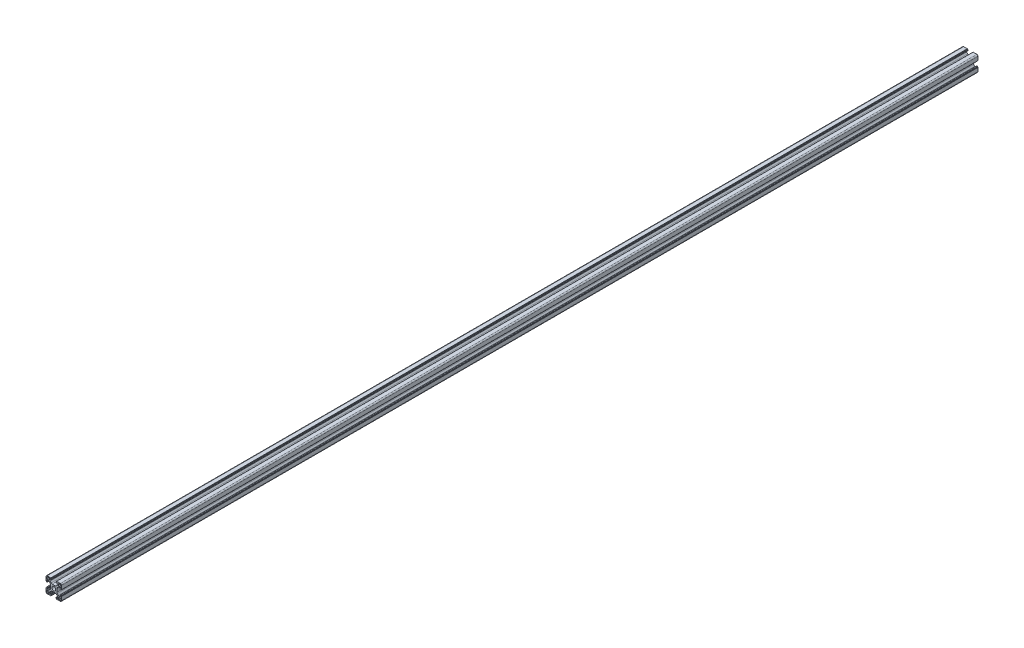
from build123d import *

# Parameters (mm, degrees)
EXTRUDE_1_DEPTH = 1180


with BuildPart() as part:
    # Эскиз1 → Бобышка-Вытянуть1 (new body)
    with BuildSketch(Plane.XY):
        with BuildLine():
            Line((0.259458272, 4.035699369), (2.158238941, 4.035699369))
            ThreePointArc((2.158238941, 4.035699369), (2.923605806, 4.187940304), (3.572452504, 4.621485807))
            Line((3.572452504, 4.621485807), (4.873671834, 5.922705138))
            ThreePointArc((4.873671834, 5.922705138), (5.307217337, 6.571551836), (5.459458272, 7.3369187))
            Line((5.459458272, 7.3369187), (5.459458272, 8.235699369))
            ThreePointArc((5.459458272, 8.235699369), (5.313011663, 8.58925276), (4.959458272, 8.735699369))
            Line((4.959458272, 8.735699369), (4.856565053, 8.735699369))
            ThreePointArc((4.856565053, 8.735699369), (4.665223337, 8.697639136), (4.503011663, 8.58925276))
            Line((4.503011663, 8.58925276), (4.022681577, 8.108922674))
            ThreePointArc((4.022681577, 8.108922674), (3.94157574, 8.054729486), (3.845904882, 8.035699369))
            Line((3.845904882, 8.035699369), (3.559458272, 8.035699369))
            ThreePointArc((3.559458272, 8.035699369), (3.382681577, 8.108922674), (3.309458272, 8.285699369))
            Line((3.309458272, 8.285699369), (3.309458272, 9.43477019))
            ThreePointArc((3.309458272, 9.43477019), (3.353392255, 9.540836207), (3.459458272, 9.58477019))
            Line((3.459458272, 9.58477019), (3.959458272, 9.58477019))
            Line((3.959458272, 9.58477019), (3.959458272, 9.885699369))
            ThreePointArc((3.959458272, 9.885699369), (4.003392255, 9.991765387), (4.109458272, 10.035699369))
            Line((4.109458272, 10.035699369), (8.759458272, 10.035699369))
            ThreePointArc((8.759458272, 10.035699369), (9.820118444, 9.596359541), (10.259458272, 8.535699369))
            Line((10.259458272, 8.535699369), (10.259458272, 3.885699369))
            ThreePointArc((10.259458272, 3.885699369), (10.215524289, 3.779633352), (10.109458272, 3.735699369))
            Line((10.109458272, 3.735699369), (9.808529093, 3.735699369))
            Line((9.808529093, 3.735699369), (9.808529093, 3.235699369))
            ThreePointArc((9.808529093, 3.235699369), (9.76459511, 3.129633352), (9.658529093, 3.085699369))
            Line((9.658529093, 3.085699369), (8.509458272, 3.085699369))
            ThreePointArc((8.509458272, 3.085699369), (8.332681577, 3.158922674), (8.259458272, 3.335699369))
            Line((8.259458272, 3.335699369), (8.259458272, 3.622145979))
            ThreePointArc((8.259458272, 3.622145979), (8.278488389, 3.717816837), (8.332681577, 3.798922674))
            Line((8.332681577, 3.798922674), (8.813011663, 4.27925276))
            ThreePointArc((8.813011663, 4.27925276), (8.921398038, 4.441464434), (8.959458272, 4.632806151))
            Line((8.959458272, 4.632806151), (8.959458272, 4.735699369))
            ThreePointArc((8.959458272, 4.735699369), (8.813011663, 5.08925276), (8.459458272, 5.235699369))
            Line((8.459458272, 5.235699369), (7.560677603, 5.235699369))
            ThreePointArc((7.560677603, 5.235699369), (6.795310738, 5.083458434), (6.146464041, 4.649912932))
            Line((6.146464041, 4.649912932), (4.84524471, 3.348693601))
            ThreePointArc((4.84524471, 3.348693601), (4.411699207, 2.699846903), (4.259458272, 1.934480039))
            Line((4.259458272, 1.934480039), (4.259458272, 0.035699369))
            Line((4.259458272, 0.035699369), (4.259458272, -1.8630813))
            ThreePointArc((4.259458272, -1.8630813), (4.411699207, -2.628448164), (4.84524471, -3.277294862))
            Line((4.84524471, -3.277294862), (6.146464041, -4.578514193))
            ThreePointArc((6.146464041, -4.578514193), (6.795310738, -5.012059696), (7.560677603, -5.164300631))
            Line((7.560677603, -5.164300631), (8.459458272, -5.164300631))
            ThreePointArc((8.459458272, -5.164300631), (8.813011663, -5.017854021), (8.959458272, -4.664300631))
            Line((8.959458272, -4.664300631), (8.959458272, -4.561407412))
            ThreePointArc((8.959458272, -4.561407412), (8.921398038, -4.370065696), (8.813011663, -4.207854021))
            Line((8.813011663, -4.207854021), (8.332681577, -3.727523935))
            ThreePointArc((8.332681577, -3.727523935), (8.278488389, -3.646418098), (8.259458272, -3.55074724))
            Line((8.259458272, -3.55074724), (8.259458272, -3.264300631))
            ThreePointArc((8.259458272, -3.264300631), (8.332681577, -3.087523935), (8.509458272, -3.014300631))
            Line((8.509458272, -3.014300631), (9.658529093, -3.014300631))
            ThreePointArc((9.658529093, -3.014300631), (9.76459511, -3.058234613), (9.808529093, -3.164300631))
            Line((9.808529093, -3.164300631), (9.808529093, -3.664300631))
            Line((9.808529093, -3.664300631), (10.109458272, -3.664300631))
            ThreePointArc((10.109458272, -3.664300631), (10.215524289, -3.708234613), (10.259458272, -3.814300631))
            Line((10.259458272, -3.814300631), (10.259458272, -8.464300631))
            ThreePointArc((10.259458272, -8.464300631), (9.820118444, -9.524960802), (8.759458272, -9.964300631))
            Line((8.759458272, -9.964300631), (4.109458272, -9.964300631))
            ThreePointArc((4.109458272, -9.964300631), (4.003392255, -9.920366648), (3.959458272, -9.814300631))
            Line((3.959458272, -9.814300631), (3.959458272, -9.513371451))
            Line((3.959458272, -9.513371451), (3.459458272, -9.513371451))
            ThreePointArc((3.459458272, -9.513371451), (3.353392255, -9.469437468), (3.309458272, -9.363371451))
            Line((3.309458272, -9.363371451), (3.309458272, -8.214300631))
            ThreePointArc((3.309458272, -8.214300631), (3.382681577, -8.037523935), (3.559458272, -7.964300631))
            Line((3.559458272, -7.964300631), (3.845904882, -7.964300631))
            ThreePointArc((3.845904882, -7.964300631), (3.94157574, -7.983330747), (4.022681577, -8.037523935))
            Line((4.022681577, -8.037523935), (4.503011663, -8.517854021))
            ThreePointArc((4.503011663, -8.517854021), (4.665223337, -8.626240397), (4.856565053, -8.664300631))
            Line((4.856565053, -8.664300631), (4.959458272, -8.664300631))
            ThreePointArc((4.959458272, -8.664300631), (5.313011663, -8.517854021), (5.459458272, -8.164300631))
            Line((5.459458272, -8.164300631), (5.459458272, -7.265519961))
            ThreePointArc((5.459458272, -7.265519961), (5.307217337, -6.500153097), (4.873671834, -5.851306399))
            Line((4.873671834, -5.851306399), (3.572452504, -4.550087068))
            ThreePointArc((3.572452504, -4.550087068), (2.923605806, -4.116541566), (2.158238941, -3.964300631))
            Line((2.158238941, -3.964300631), (0.259458272, -3.964300631))
            Line((0.259458272, -3.964300631), (-1.639322397, -3.964300631))
            ThreePointArc((-1.639322397, -3.964300631), (-2.404689262, -4.116541566), (-3.053535959, -4.550087068))
            Line((-3.053535959, -4.550087068), (-4.35475529, -5.851306399))
            ThreePointArc((-4.35475529, -5.851306399), (-4.788300793, -6.500153097), (-4.940541728, -7.265519961))
            Line((-4.940541728, -7.265519961), (-4.940541728, -8.164300631))
            ThreePointArc((-4.940541728, -8.164300631), (-4.794095118, -8.517854021), (-4.440541728, -8.664300631))
            Line((-4.440541728, -8.664300631), (-4.337648509, -8.664300631))
            ThreePointArc((-4.337648509, -8.664300631), (-4.146306793, -8.626240397), (-3.984095118, -8.517854021))
            Line((-3.984095118, -8.517854021), (-3.503765033, -8.037523935))
            ThreePointArc((-3.503765033, -8.037523935), (-3.422659195, -7.983330747), (-3.326988337, -7.964300631))
            Line((-3.326988337, -7.964300631), (-3.040541728, -7.964300631))
            ThreePointArc((-3.040541728, -7.964300631), (-2.863765033, -8.037523935), (-2.790541728, -8.214300631))
            Line((-2.790541728, -8.214300631), (-2.790541728, -9.363371451))
            ThreePointArc((-2.790541728, -9.363371451), (-2.834475711, -9.469437468), (-2.940541728, -9.513371451))
            Line((-2.940541728, -9.513371451), (-3.440541728, -9.513371451))
            Line((-3.440541728, -9.513371451), (-3.440541728, -9.814300631))
            ThreePointArc((-3.440541728, -9.814300631), (-3.484475711, -9.920366648), (-3.590541728, -9.964300631))
            Line((-3.590541728, -9.964300631), (-8.240541728, -9.964300631))
            ThreePointArc((-8.240541728, -9.964300631), (-9.3012019, -9.524960802), (-9.740541728, -8.464300631))
            Line((-9.740541728, -8.464300631), (-9.740541728, -3.814300631))
            ThreePointArc((-9.740541728, -3.814300631), (-9.696607745, -3.708234613), (-9.590541728, -3.664300631))
            Line((-9.590541728, -3.664300631), (-9.289612548, -3.664300631))
            Line((-9.289612548, -3.664300631), (-9.289612548, -3.164300631))
            ThreePointArc((-9.289612548, -3.164300631), (-9.245678566, -3.058234613), (-9.139612548, -3.014300631))
            Line((-9.139612548, -3.014300631), (-7.990541728, -3.014300631))
            ThreePointArc((-7.990541728, -3.014300631), (-7.813765033, -3.087523935), (-7.740541728, -3.264300631))
            Line((-7.740541728, -3.264300631), (-7.740541728, -3.55074724))
            ThreePointArc((-7.740541728, -3.55074724), (-7.759571845, -3.646418098), (-7.813765033, -3.727523935))
            Line((-7.813765033, -3.727523935), (-8.294095118, -4.207854021))
            ThreePointArc((-8.294095118, -4.207854021), (-8.402481494, -4.370065696), (-8.440541728, -4.561407412))
            Line((-8.440541728, -4.561407412), (-8.440541728, -4.664300631))
            ThreePointArc((-8.440541728, -4.664300631), (-8.294095118, -5.017854021), (-7.940541728, -5.164300631))
            Line((-7.940541728, -5.164300631), (-7.041761059, -5.164300631))
            ThreePointArc((-7.041761059, -5.164300631), (-6.276394194, -5.012059696), (-5.627547496, -4.578514193))
            Line((-5.627547496, -4.578514193), (-4.326328166, -3.277294862))
            ThreePointArc((-4.326328166, -3.277294862), (-3.892782663, -2.628448164), (-3.740541728, -1.8630813))
            Line((-3.740541728, -1.8630813), (-3.740541728, 0.035699369))
            Line((-3.740541728, 0.035699369), (-3.740541728, 1.934480039))
            ThreePointArc((-3.740541728, 1.934480039), (-3.892782663, 2.699846903), (-4.326328166, 3.348693601))
            Line((-4.326328166, 3.348693601), (-5.627547496, 4.649912932))
            ThreePointArc((-5.627547496, 4.649912932), (-6.276394194, 5.083458434), (-7.041761059, 5.235699369))
            Line((-7.041761059, 5.235699369), (-7.940541728, 5.235699369))
            ThreePointArc((-7.940541728, 5.235699369), (-8.294095118, 5.08925276), (-8.440541728, 4.735699369))
            Line((-8.440541728, 4.735699369), (-8.440541728, 4.632806151))
            ThreePointArc((-8.440541728, 4.632806151), (-8.402481494, 4.441464434), (-8.294095118, 4.27925276))
            Line((-8.294095118, 4.27925276), (-7.813765033, 3.798922674))
            ThreePointArc((-7.813765033, 3.798922674), (-7.759571845, 3.717816837), (-7.740541728, 3.622145979))
            Line((-7.740541728, 3.622145979), (-7.740541728, 3.335699369))
            ThreePointArc((-7.740541728, 3.335699369), (-7.813765033, 3.158922674), (-7.990541728, 3.085699369))
            Line((-7.990541728, 3.085699369), (-9.139612548, 3.085699369))
            ThreePointArc((-9.139612548, 3.085699369), (-9.245678566, 3.129633352), (-9.289612548, 3.235699369))
            Line((-9.289612548, 3.235699369), (-9.289612548, 3.735699369))
            Line((-9.289612548, 3.735699369), (-9.590541728, 3.735699369))
            ThreePointArc((-9.590541728, 3.735699369), (-9.696607745, 3.779633352), (-9.740541728, 3.885699369))
            Line((-9.740541728, 3.885699369), (-9.740541728, 8.535699369))
            ThreePointArc((-9.740541728, 8.535699369), (-9.3012019, 9.596359541), (-8.240541728, 10.035699369))
            Line((-8.240541728, 10.035699369), (-3.590541728, 10.035699369))
            ThreePointArc((-3.590541728, 10.035699369), (-3.484475711, 9.991765387), (-3.440541728, 9.885699369))
            Line((-3.440541728, 9.885699369), (-3.440541728, 9.58477019))
            Line((-3.440541728, 9.58477019), (-2.940541728, 9.58477019))
            ThreePointArc((-2.940541728, 9.58477019), (-2.834475711, 9.540836207), (-2.790541728, 9.43477019))
            Line((-2.790541728, 9.43477019), (-2.790541728, 8.285699369))
            ThreePointArc((-2.790541728, 8.285699369), (-2.863765033, 8.108922674), (-3.040541728, 8.035699369))
            Line((-3.040541728, 8.035699369), (-3.326988337, 8.035699369))
            ThreePointArc((-3.326988337, 8.035699369), (-3.422659195, 8.054729486), (-3.503765033, 8.108922674))
            Line((-3.503765033, 8.108922674), (-3.984095118, 8.58925276))
            ThreePointArc((-3.984095118, 8.58925276), (-4.146306793, 8.697639136), (-4.337648509, 8.735699369))
            Line((-4.337648509, 8.735699369), (-4.440541728, 8.735699369))
            ThreePointArc((-4.440541728, 8.735699369), (-4.794095118, 8.58925276), (-4.940541728, 8.235699369))
            Line((-4.940541728, 8.235699369), (-4.940541728, 7.3369187))
            ThreePointArc((-4.940541728, 7.3369187), (-4.788300793, 6.571551836), (-4.35475529, 5.922705138))
            Line((-4.35475529, 5.922705138), (-3.053535959, 4.621485807))
            ThreePointArc((-3.053535959, 4.621485807), (-2.404689262, 4.187940304), (-1.639322397, 4.035699369))
            Line((-1.639322397, 4.035699369), (0.259458272, 4.035699369))
        make_face()
        with BuildLine():
            Line((7.159458272, 6.135699369), (8.559458272, 6.135699369))
            ThreePointArc((8.559458272, 6.135699369), (9.125143697, 6.370013944), (9.359458272, 6.935699369))
            Line((9.359458272, 6.935699369), (9.359458272, 8.335699369))
            ThreePointArc((9.359458272, 8.335699369), (9.125143697, 8.901384794), (8.559458272, 9.135699369))
            Line((8.559458272, 9.135699369), (7.159458272, 9.135699369))
            ThreePointArc((7.159458272, 9.135699369), (6.593772847, 8.901384794), (6.359458272, 8.335699369))
            Line((6.359458272, 8.335699369), (6.359458272, 6.935699369))
            ThreePointArc((6.359458272, 6.935699369), (6.593772847, 6.370013944), (7.159458272, 6.135699369))
        make_face(mode=Mode.SUBTRACT)
        with BuildLine():
            Line((6.359458272, -6.864300631), (6.359458272, -8.264300631))
            ThreePointArc((6.359458272, -8.264300631), (6.593772847, -8.829986056), (7.159458272, -9.064300631))
            Line((7.159458272, -9.064300631), (8.559458272, -9.064300631))
            ThreePointArc((8.559458272, -9.064300631), (9.125143697, -8.829986056), (9.359458272, -8.264300631))
            Line((9.359458272, -8.264300631), (9.359458272, -6.864300631))
            ThreePointArc((9.359458272, -6.864300631), (9.125143697, -6.298615206), (8.559458272, -6.064300631))
            Line((8.559458272, -6.064300631), (7.159458272, -6.064300631))
            ThreePointArc((7.159458272, -6.064300631), (6.593772847, -6.298615206), (6.359458272, -6.864300631))
        make_face(mode=Mode.SUBTRACT)
        with BuildLine():
            Line((-6.640541728, -6.064300631), (-8.040541728, -6.064300631))
            ThreePointArc((-8.040541728, -6.064300631), (-8.606227153, -6.298615206), (-8.840541728, -6.864300631))
            Line((-8.840541728, -6.864300631), (-8.840541728, -8.264300631))
            ThreePointArc((-8.840541728, -8.264300631), (-8.606227153, -8.829986056), (-8.040541728, -9.064300631))
            Line((-8.040541728, -9.064300631), (-6.640541728, -9.064300631))
            ThreePointArc((-6.640541728, -9.064300631), (-6.074856303, -8.829986056), (-5.840541728, -8.264300631))
            Line((-5.840541728, -8.264300631), (-5.840541728, -6.864300631))
            ThreePointArc((-5.840541728, -6.864300631), (-6.074856303, -6.298615206), (-6.640541728, -6.064300631))
        make_face(mode=Mode.SUBTRACT)
        with BuildLine():
            Line((-5.840541728, 6.935699369), (-5.840541728, 8.335699369))
            ThreePointArc((-5.840541728, 8.335699369), (-6.074856303, 8.901384794), (-6.640541728, 9.135699369))
            Line((-6.640541728, 9.135699369), (-8.040541728, 9.135699369))
            ThreePointArc((-8.040541728, 9.135699369), (-8.606227153, 8.901384794), (-8.840541728, 8.335699369))
            Line((-8.840541728, 8.335699369), (-8.840541728, 6.935699369))
            ThreePointArc((-8.840541728, 6.935699369), (-8.606227153, 6.370013944), (-8.040541728, 6.135699369))
            Line((-8.040541728, 6.135699369), (-6.640541728, 6.135699369))
            ThreePointArc((-6.640541728, 6.135699369), (-6.074856303, 6.370013944), (-5.840541728, 6.935699369))
        make_face(mode=Mode.SUBTRACT)
        with BuildLine():
            ThreePointArc((2.759458272, 0.035699369), (2.027225225, 1.803466322), (0.259458272, 2.535699369))
            ThreePointArc((0.259458272, 2.535699369), (-1.508308681, 1.803466322), (-2.240541728, 0.035699369))
            ThreePointArc((-2.240541728, 0.035699369), (-1.508308681, -1.732067584), (0.259458272, -2.464300631))
            ThreePointArc((0.259458272, -2.464300631), (2.027225225, -1.732067584), (2.759458272, 0.035699369))
        make_face(mode=Mode.SUBTRACT)
    extrude(amount=EXTRUDE_1_DEPTH)


solid = part.part
